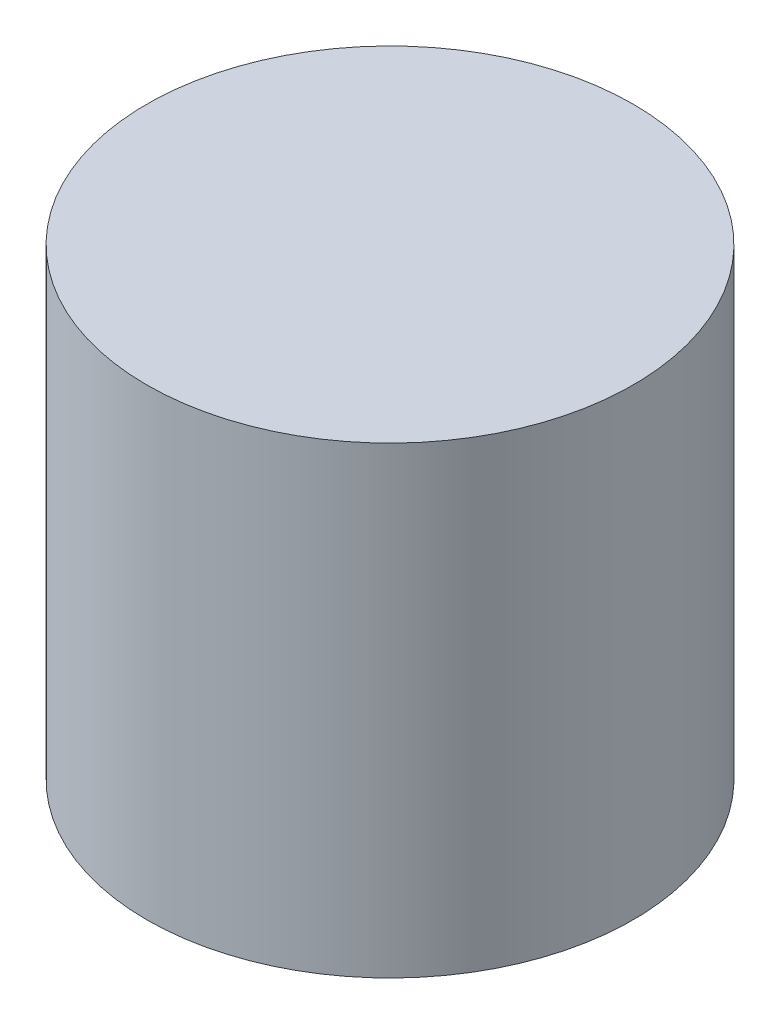
from build123d import *

# Parameters (mm, degrees)
CROQUIS1_R              = 3.15
SALIENTE_EXTRUIR1_DEPTH = 6


with BuildPart() as part:
    # Croquis1 → Saliente-Extruir1 (new body)
    with BuildSketch(Plane(origin=(0, 0, 0), x_dir=(1, 0, 0), z_dir=(0, 1, 0))):
        with Locations(Location((0, 0, 0), (0, 0, 270))):
            Circle(CROQUIS1_R)
    extrude(amount=SALIENTE_EXTRUIR1_DEPTH)


solid = part.part
